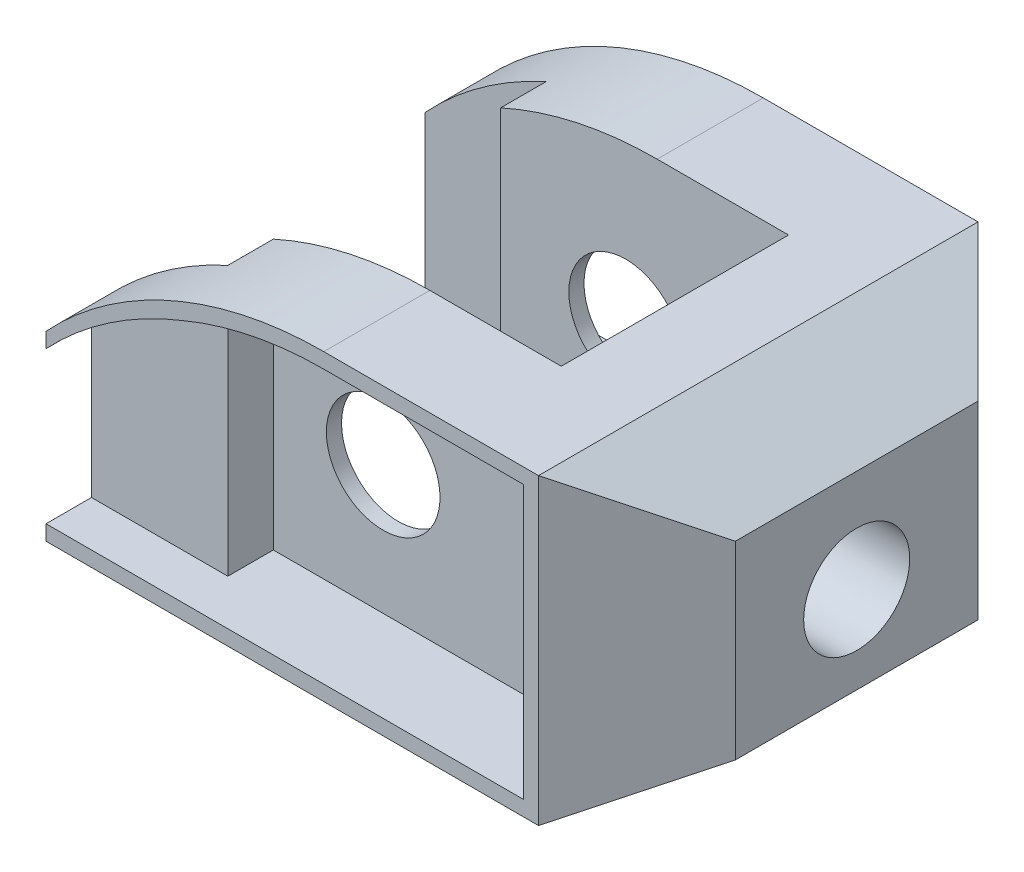
from build123d import *

# Parameters (mm, degrees)
SKETCH1_R               = 7.5
BOSS_EXTRUDE1_DEPTH     = 58
CUT_EXTRUDE1_DEPTH      = 84.865217872
CUT_EXTRUDE1_DEPTH_BACK = 84.865217872
SKETCH2_W               = 38
SKETCH2_H               = 30
CUT_EXTRUDE4_DEPTH      = 84.865217872
CUT_EXTRUDE4_DEPTH_BACK = 84.865217872
SKETCH3_W               = 16
SKETCH3_H               = 6
CUT_EXTRUDE5_DEPTH      = 100.435906681
CUT_EXTRUDE5_DEPTH_BACK = 100.435906681
SKETCH4_R               = 7
CUT_EXTRUDE6_DEPTH      = 84.865217872
CUT_EXTRUDE6_DEPTH_BACK = 84.865217872
SKETCH9_R               = 7.5
CUT_EXTRUDE10_DEPTH     = 12
CUT_EXTRUDE12_DEPTH     = 6
CUT_EXTRUDE13_DEPTH     = 12
CUT_EXTRUDE14_DEPTH     = 6


with BuildPart() as part:
    # Sketch1 → Boss-Extrude1 (new body)
    with BuildSketch(Plane.XY):
        with BuildLine():
            Line((32.5, -19), (-32.5, -19))
            Line((-32.5, -19), (-32.5, 5))
            ThreePointArc((-32.5, 5), (-15.83939444, 16.82575695), (4.16060556, 21))
            Line((4.16060556, 21), (32.5, 21))
            Line((32.5, 21), (45.490381057, 13.5))
            Line((45.490381057, 13.5), (45.490381057, -11.5))
            Line((45.490381057, -11.5), (32.5, -19))
        make_face()
        with Locations(Location((0, 0, 0), (0, 0, 180))):
            Circle(SKETCH1_R, mode=Mode.SUBTRACT)
    extrude(amount=BOSS_EXTRUDE1_DEPTH)

    # Sketch2 → Cut-Extrude1 (cut, two sides: drawn at the far end of the back side and taken through both)
    with BuildSketch(Plane(origin=(0, 21, 0), x_dir=(1, 0, 0), z_dir=(0, 1, 0)).offset(-CUT_EXTRUDE1_DEPTH_BACK)):
        with Locations((2.5, -29)):
            Rectangle(SKETCH2_W, SKETCH2_H)
    extrude(amount=CUT_EXTRUDE1_DEPTH + CUT_EXTRUDE1_DEPTH_BACK, mode=Mode.SUBTRACT)

    # Sketch3 → Cut-Extrude4 (cut, two sides: drawn at the far end of the back side and taken through both)
    with BuildSketch(Plane(origin=(0, 21, 0), x_dir=(1, 0, 0), z_dir=(0, 1, 0)).offset(-CUT_EXTRUDE4_DEPTH_BACK)):
        with Locations((-24.5, -47)):
            Rectangle(SKETCH3_W, SKETCH3_H)
        with Locations((-24.5, -11)):
            Rectangle(SKETCH3_W, SKETCH3_H)
    extrude(amount=CUT_EXTRUDE4_DEPTH + CUT_EXTRUDE4_DEPTH_BACK, mode=Mode.SUBTRACT)


with BuildPart() as body_2:
    # of the pieces the cut leaves, the one that is kept (cut_extrude4_keep)
    add(part.part.solids().sort_by_distance((4.16060556, 21, 0))[0])

    # Sketch4 → Cut-Extrude5 (cut, two sides: drawn at the far end of the back side and taken through both)
    with BuildSketch(Plane(origin=(45.490381057, 0, 0), x_dir=(0, 0, -1), z_dir=(1, 0, 0)).offset(-CUT_EXTRUDE5_DEPTH_BACK)):
        with Locations(Location((-29, 0, 0), (0, 0, 90))):
            Circle(SKETCH4_R)
    extrude(amount=CUT_EXTRUDE5_DEPTH + CUT_EXTRUDE5_DEPTH_BACK, mode=Mode.SUBTRACT)

    # Sketch6 → Cut-Extrude6 (cut, two sides: drawn at the far end of the back side and taken through both)
    with BuildSketch(Plane(origin=(0, 21, 0), x_dir=(1, 0, 0), z_dir=(0, 1, 0)).offset(-CUT_EXTRUDE6_DEPTH_BACK)):
        Polygon((32.5, 0), (45.490381057, -12.990381057), (45.490381057, 0), align=None)
        Polygon((45.490381057, -45.009618943), (45.490381057, -58), (32.5, -58), align=None)
    extrude(amount=CUT_EXTRUDE6_DEPTH + CUT_EXTRUDE6_DEPTH_BACK, mode=Mode.SUBTRACT)

    # Sketch9 → Cut-Extrude10 (cut)
    with BuildSketch(Plane.XY.offset(58)):
        with BuildLine():
            Line((30.5, 19), (4.16060556, 19))
            ThreePointArc((4.16060556, 19), (-5.358778616, 18.046586751), (-14.5, 15.224221872))
            Line((-14.5, 15.224221872), (-14.5, -17))
            Line((-14.5, -17), (30.5, -17))
            Line((30.5, -17), (30.5, 19))
        make_face()
        with Locations(Location((0, 0, 0), (0, 0, 180))):
            Circle(SKETCH9_R, mode=Mode.SUBTRACT)
    extrude(amount=-CUT_EXTRUDE10_DEPTH, mode=Mode.SUBTRACT)

    # Sketch10 → Cut-Extrude12 (cut)
    with BuildSketch(Plane.XY.offset(58)):
        with BuildLine():
            Line((-14.5, 15.224221872), (-14.5, -17))
            Line((-14.5, -17), (-32.5, -17))
            Line((-32.5, -17), (-32.5, 3))
            ThreePointArc((-32.5, 3), (-24.178137204, 10.110658721), (-14.5, 15.224221872))
        make_face()
    extrude(amount=-CUT_EXTRUDE12_DEPTH, mode=Mode.SUBTRACT)

    # Sketch14 → Cut-Extrude13 (cut)
    with BuildSketch(Plane(origin=(0, 0, 0), x_dir=(-1, 0, 0), z_dir=(0, 0, -1))):
        with BuildLine():
            Line((14.5, -17), (14.5, 15.224221872))
            ThreePointArc((14.5, 15.224221872), (5.358778616, 18.046586751), (-4.16060556, 19))
            Line((-4.16060556, 19), (-30.5, 19))
            Line((-30.5, 19), (-30.5, -17))
            Line((-30.5, -17), (14.5, -17))
        make_face()
    extrude(amount=-CUT_EXTRUDE13_DEPTH, mode=Mode.SUBTRACT)

    # Sketch15 → Cut-Extrude14 (cut)
    with BuildSketch(Plane(origin=(0, 0, 0), x_dir=(-1, 0, 0), z_dir=(0, 0, -1))):
        with BuildLine():
            Line((14.5, 15.224221872), (14.5, -17))
            Line((14.5, -17), (32.5, -17))
            Line((32.5, -17), (32.5, 1.972887098))
            ThreePointArc((32.5, 1.972887098), (24.250830172, 9.618447449), (14.5, 15.224221872))
        make_face()
    extrude(amount=-CUT_EXTRUDE14_DEPTH, mode=Mode.SUBTRACT)


solid = body_2.part
